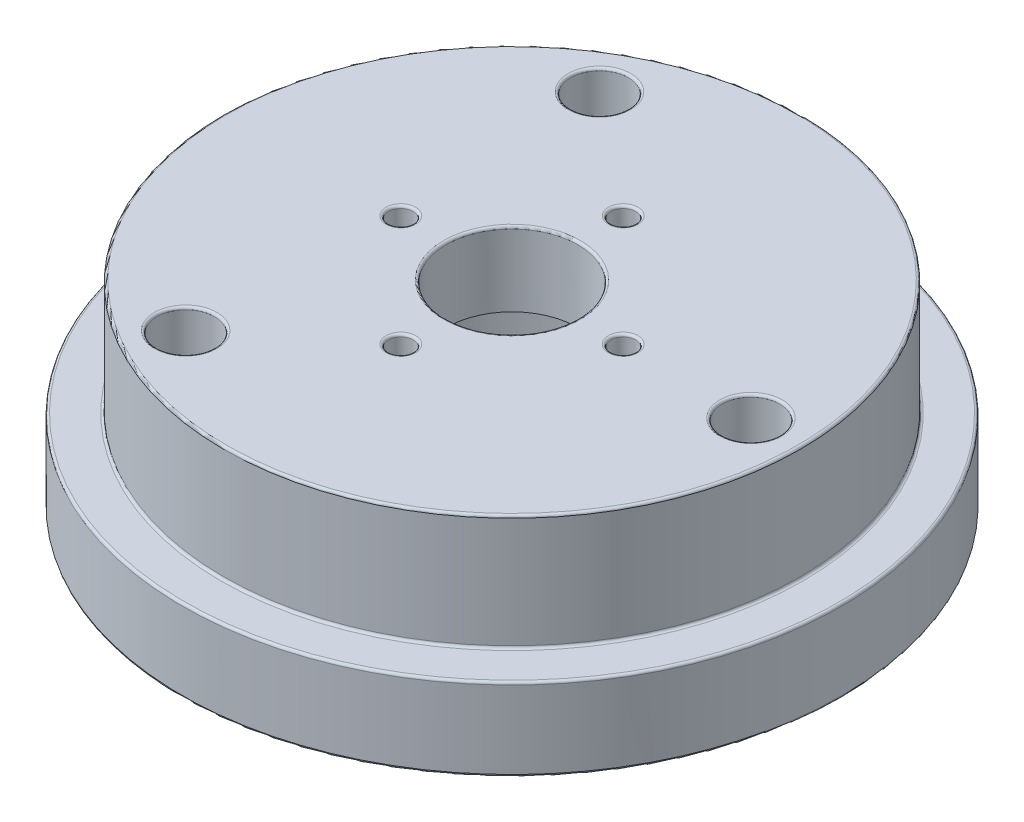
from build123d import *

# Parameters (mm, degrees)
SKETCH2_R          = 1.75
SKETCH2_R_2        = 4
SKETCH2_R_3        = 0.75
CUT_EXTRUDE1_DEPTH = 31.724582991
SKETCH2_3_R        = 10
CUT_EXTRUDE2_DEPTH = 7.5
FILLET1_R          = 0.15


with BuildPart() as part:
    # Sketch1 → Revolve1 (revolve)
    with BuildSketch(Plane.XY):
        Polygon((0, 0), (-20, 0), (-20, 5), (-17.5, 5), (-17.5, 12), (0, 12), align=None)
    revolve(axis=Axis((0, 12, 0), (0, -1, 0)))

    # Sketch2 → Cut-Extrude1 (cut, through all)
    with BuildSketch(Plane.XZ):
        with Locations((14.5, 0)):
            Circle(SKETCH2_R)
        with Locations((-7.25, -12.557368355)):
            Circle(SKETCH2_R)
        with Locations((-7.25, 12.557368355)):
            Circle(SKETCH2_R)
        Circle(SKETCH2_R_2)
        with Locations((6.75, 0)):
            Circle(SKETCH2_R_3)
        with Locations((0, -6.75)):
            Circle(SKETCH2_R_3)
        with Locations((-6.75, 0)):
            Circle(SKETCH2_R_3)
        with Locations((0, 6.75)):
            Circle(SKETCH2_R_3)
    extrude(amount=-CUT_EXTRUDE1_DEPTH, mode=Mode.SUBTRACT)

    # Sketch2<3> → Cut-Extrude2 (cut)
    with BuildSketch(Plane.XZ):
        Circle(SKETCH2_3_R)
    extrude(amount=-CUT_EXTRUDE2_DEPTH, mode=Mode.SUBTRACT)

    # Fillet1
    fillet1_edges = [part.edges().sort_by_distance(p)[0] for p in [
        (20, 0, 0),
        (12.75, 0, 0),
        (-9, 0, -12.557368355),
        (-9, 0, 12.557368355),
        (-10, 0, 0),
        (17.5, 5, 0),
        (20, 5, 0),
        (17.5, 12, 0),
        (-7.5, 12, 0),
        (-4, 12, 0),
        (12.75, 12, 0),
        (-9, 12, -12.557368355),
        (-0.75, 12, 6.75),
        (-0.75, 12, -6.75),
        (6, 12, 0),
        (-9, 12, 12.557368355),
    ]]
    fillet(fillet1_edges, radius=FILLET1_R)


solid = part.part
